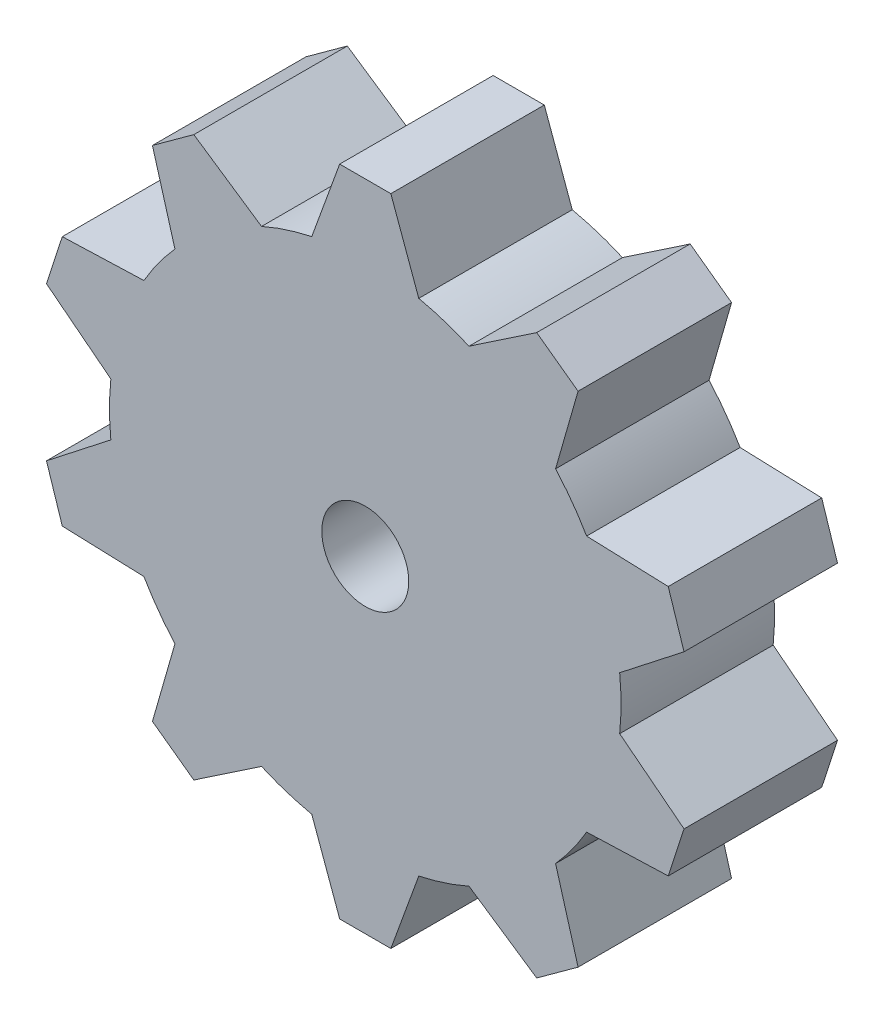
from build123d import *

# Parameters (mm, degrees)
SKETCH1_R           = 0.85
BOSS_EXTRUDE1_DEPTH = 3


with BuildPart() as part:
    # Sketch1 → Boss-Extrude1 (new body)
    with BuildSketch(Plane.XY):
        with BuildLine():
            Line((-1.045955351, 4.889373927), (-0.5, 6.389373927))
            Line((-0.5, 6.389373927), (0.5, 6.389373927))
            Line((0.5, 6.389373927), (1.045955351, 4.889373927))
            ThreePointArc((1.045955351, 4.889373927), (1.545084972, 4.755282581), (2.027706233, 4.570383729))
            Line((2.027706233, 4.570383729), (3.351071269, 5.463004717))
            Line((3.351071269, 5.463004717), (4.160088263, 4.875219465))
            Line((4.160088263, 4.875219465), (3.720097542, 3.340789469))
            ThreePointArc((3.720097542, 3.340789469), (4.045084972, 2.938926261), (4.326852955, 2.505662288))
            Line((4.326852955, 2.505662288), (5.922147212, 2.449953385))
            Line((5.922147212, 2.449953385), (6.231164206, 1.498896869))
            Line((6.231164206, 1.498896869), (4.973288913, 0.516136983))
            ThreePointArc((4.973288913, 0.516136983), (5, 0), (4.973288913, -0.516136983))
            Line((4.973288913, -0.516136983), (6.231164206, -1.498896869))
            Line((6.231164206, -1.498896869), (5.922147212, -2.449953385))
            Line((5.922147212, -2.449953385), (4.326852955, -2.505662288))
            ThreePointArc((4.326852955, -2.505662288), (4.045084972, -2.938926261), (3.720097542, -3.340789469))
            Line((3.720097542, -3.340789469), (4.160088263, -4.875219465))
            Line((4.160088263, -4.875219465), (3.351071269, -5.463004717))
            Line((3.351071269, -5.463004717), (2.027706233, -4.570383729))
            ThreePointArc((2.027706233, -4.570383729), (1.545084972, -4.755282581), (1.045955351, -4.889373927))
            Line((1.045955351, -4.889373927), (0.5, -6.389373927))
            Line((0.5, -6.389373927), (-0.5, -6.389373927))
            Line((-0.5, -6.389373927), (-1.045955351, -4.889373927))
            ThreePointArc((-1.045955351, -4.889373927), (-1.545084972, -4.755282581), (-2.027706233, -4.570383729))
            Line((-2.027706233, -4.570383729), (-3.351071269, -5.463004717))
            Line((-3.351071269, -5.463004717), (-4.160088263, -4.875219465))
            Line((-4.160088263, -4.875219465), (-3.720097542, -3.340789469))
            ThreePointArc((-3.720097542, -3.340789469), (-4.045084972, -2.938926261), (-4.326852955, -2.505662288))
            Line((-4.326852955, -2.505662288), (-5.922147212, -2.449953385))
            Line((-5.922147212, -2.449953385), (-6.231164206, -1.498896869))
            Line((-6.231164206, -1.498896869), (-4.973288913, -0.516136983))
            ThreePointArc((-4.973288913, -0.516136983), (-5, 0), (-4.973288913, 0.516136983))
            Line((-4.973288913, 0.516136983), (-6.231164206, 1.498896869))
            Line((-6.231164206, 1.498896869), (-5.922147212, 2.449953385))
            Line((-5.922147212, 2.449953385), (-4.326852955, 2.505662288))
            ThreePointArc((-4.326852955, 2.505662288), (-4.045084972, 2.938926261), (-3.720097542, 3.340789469))
            Line((-3.720097542, 3.340789469), (-4.160088263, 4.875219465))
            Line((-4.160088263, 4.875219465), (-3.351071269, 5.463004717))
            Line((-3.351071269, 5.463004717), (-2.027706233, 4.570383729))
            ThreePointArc((-2.027706233, 4.570383729), (-1.545084972, 4.755282581), (-1.045955351, 4.889373927))
        make_face()
        Circle(SKETCH1_R, mode=Mode.SUBTRACT)
    extrude(amount=BOSS_EXTRUDE1_DEPTH)


solid = part.part
